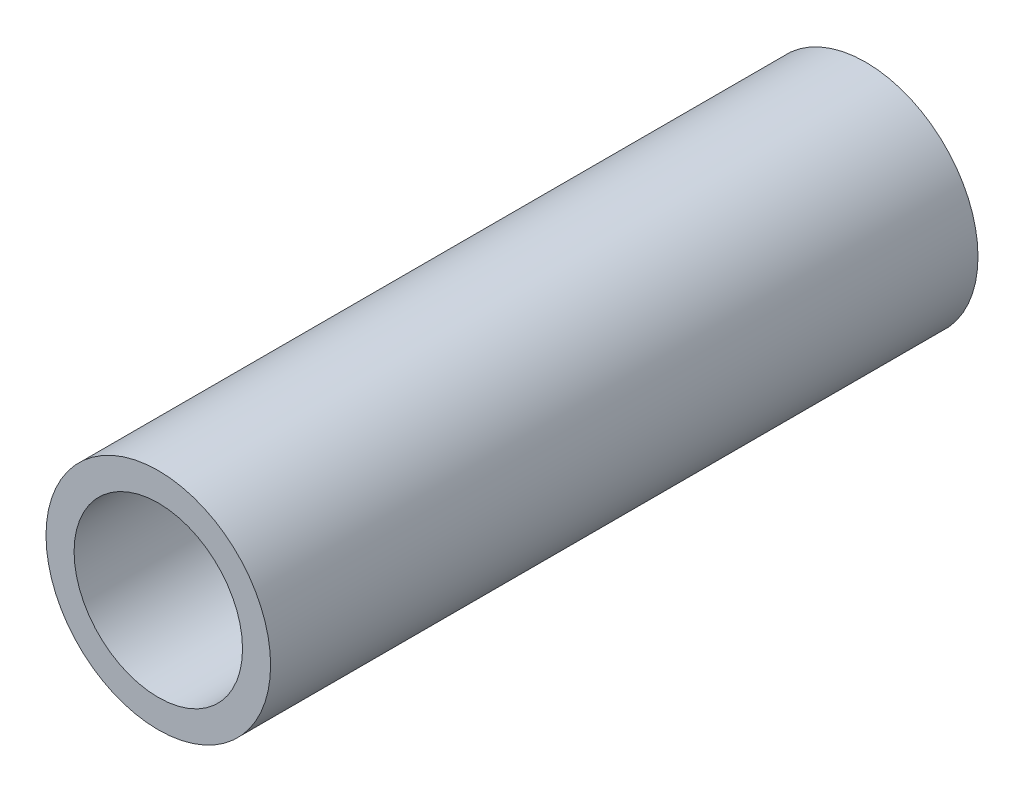
from build123d import *

# Parameters (mm, degrees)
ESBO_O1_R                = 3.175
ESBO_O1_R_2              = 2.38125
RESSALTO_EXTRUS_O1_DEPTH = 20


with BuildPart() as part:
    # Esboço1 → Ressalto-extrusão1 (new body)
    with BuildSketch(Plane.XY):
        Circle(ESBO_O1_R)
        Circle(ESBO_O1_R_2, mode=Mode.SUBTRACT)
    extrude(amount=RESSALTO_EXTRUS_O1_DEPTH)


solid = part.part
